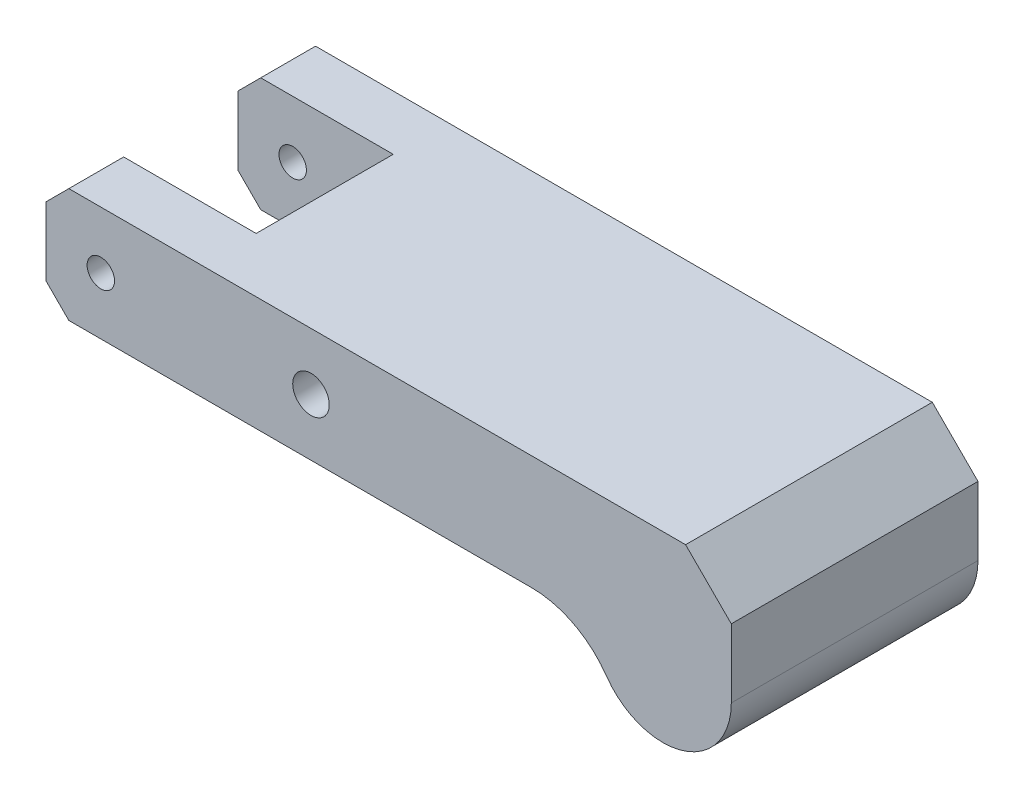
from build123d import *

# Parameters (mm, degrees)
SCHIZZO1_W                   = 150
SCHIZZO1_H                   = 25
ESTRUSIONE_ESTRUSIONE1_DEPTH = 54
ESTRUSIONE_ESTRUSIONE2_DEPTH = 54
SCHIZZO3_W                   = 34
SCHIZZO3_H                   = 30
TAGLIO_ESTRUSIONE1_DEPTH     = 25
SCHIZZO4_R                   = 4
SCHIZZO4_R_2                 = 3
TAGLIO_ESTRUSIONE2_DEPTH     = 54
SMUSSO1_SIZE                 = 5
SMUSSO2_SIZE                 = 10


with BuildPart() as part:
    # Schizzo1 → Estrusione-Estrusione1 (new body)
    with BuildSketch(Plane.XY):
        Rectangle(SCHIZZO1_W, SCHIZZO1_H)
    extrude(amount=ESTRUSIONE_ESTRUSIONE1_DEPTH)

    # Schizzo2 → Estrusione-Estrusione2 (add)
    with BuildSketch(Plane(origin=(0, 0, 0), x_dir=(-1, 0, 0), z_dir=(0, 0, -1))):
        with BuildLine():
            Line((-75, -12.5), (-31.277186767, -12.5))
            ThreePointArc((-31.277186767, -12.5), (-40.535387765, -14.771894791), (-47.6902229, -21.071428571))
            ThreePointArc((-47.6902229, -21.071428571), (-64.491845028, -26.811650088), (-75, -12.5))
        make_face()
    extrude(amount=-ESTRUSIONE_ESTRUSIONE2_DEPTH)

    # Schizzo3 → Taglio-Estrusione1 (cut)
    with BuildSketch(Plane(origin=(0, 12.5, 0), x_dir=(1, 0, 0), z_dir=(0, 1, 0))):
        with Locations((-58, -27)):
            Rectangle(SCHIZZO3_W, SCHIZZO3_H)
    extrude(amount=-TAGLIO_ESTRUSIONE1_DEPTH, mode=Mode.SUBTRACT)

    # Schizzo4 → Taglio-Estrusione2 (cut)
    with BuildSketch(Plane(origin=(0, 0, 0), x_dir=(-1, 0, 0), z_dir=(0, 0, -1))):
        with Locations((17, 0)):
            Circle(SCHIZZO4_R)
        with Locations((63, 0)):
            Circle(SCHIZZO4_R_2)
    extrude(amount=-TAGLIO_ESTRUSIONE2_DEPTH, mode=Mode.SUBTRACT)

    # Smusso1
    smusso1_edges = [part.edges().sort_by_distance(p)[0] for p in [
        (-75, 12.5, 6),
        (-75, -12.5, 6),
        (-75, 12.5, 48),
        (-75, -12.5, 48),
    ]]
    chamfer(smusso1_edges, length=SMUSSO1_SIZE)

    # Smusso2
    smusso2_edges = [part.edges().sort_by_distance(p)[0] for p in [
        (75, 12.5, 27),
    ]]
    chamfer(smusso2_edges, length=SMUSSO2_SIZE)


solid = part.part
